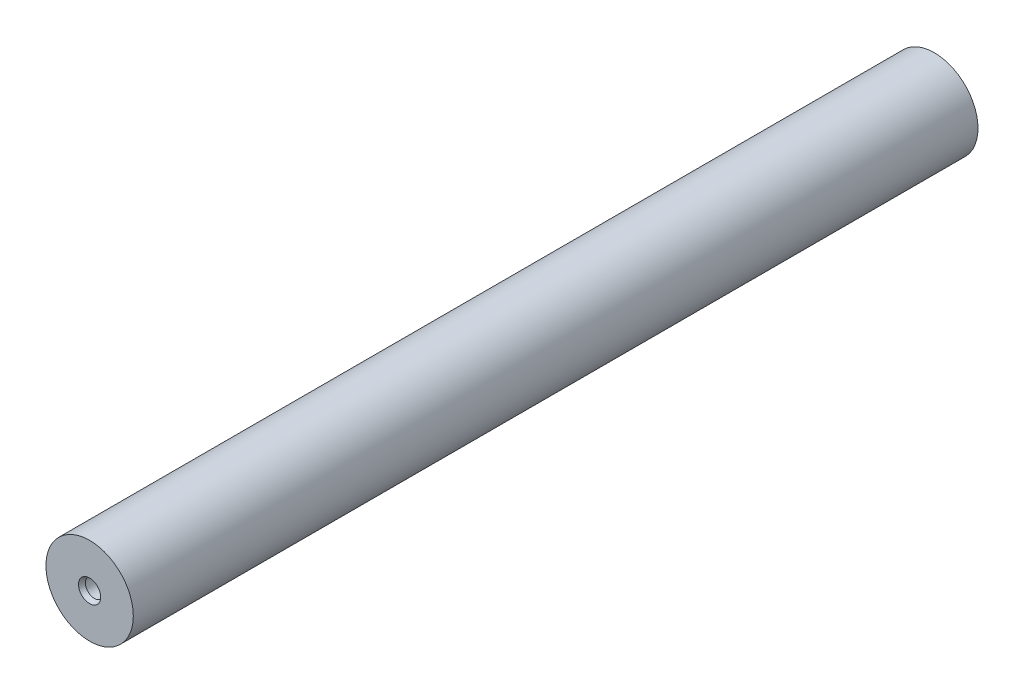
from build123d import *

# Parameters (mm, degrees)
SKETCH_1_R                   = 6
EXTRUDE_1_DEPTH              = 116
HOLE_WIZARD_M3_3_D           = 2.5
HOLE_WIZARD_M3_3_DEPTH       = 6.748924226
HOLE_WIZARD_M3_3_CSINK_D     = 3.05
HOLE_WIZARD_M3_3_CSINK_ANGLE = 45
HOLE_WIZARD_M3_3_TIP         = 0.751075774
HOLE_WIZARD_M3_4_D           = 2.5
HOLE_WIZARD_M3_4_DEPTH       = 6.748924226
HOLE_WIZARD_M3_4_CSINK_D     = 3.05
HOLE_WIZARD_M3_4_CSINK_ANGLE = 45
HOLE_WIZARD_M3_4_TIP         = 0.751075774


with BuildPart() as part:
    # 草圖1 → 填料-伸長1 (new body)
    with BuildSketch(Plane.XY):
        Circle(SKETCH_1_R)
    extrude(amount=EXTRUDE_1_DEPTH)

    # M3 螺紋孔3
    with Locations(Plane.XY.offset(116)):
        with Locations((0, 0)):
            CounterSinkHole(HOLE_WIZARD_M3_3_D / 2, HOLE_WIZARD_M3_3_CSINK_D / 2, depth=HOLE_WIZARD_M3_3_DEPTH, counter_sink_angle=HOLE_WIZARD_M3_3_CSINK_ANGLE)
            with Locations((0, 0, -(HOLE_WIZARD_M3_3_DEPTH + HOLE_WIZARD_M3_3_TIP / 2))):  # 118° drill point
                Cone(0, HOLE_WIZARD_M3_3_D / 2, HOLE_WIZARD_M3_3_TIP, mode=Mode.SUBTRACT)

    # M3 螺紋孔4
    with Locations(Plane(origin=(0, 0, 0), x_dir=(-1, 0, 0), z_dir=(0, 0, -1))):
        with Locations((0, 0)):
            CounterSinkHole(HOLE_WIZARD_M3_4_D / 2, HOLE_WIZARD_M3_4_CSINK_D / 2, depth=HOLE_WIZARD_M3_4_DEPTH, counter_sink_angle=HOLE_WIZARD_M3_4_CSINK_ANGLE)
            with Locations((0, 0, -(HOLE_WIZARD_M3_4_DEPTH + HOLE_WIZARD_M3_4_TIP / 2))):  # 118° drill point
                Cone(0, HOLE_WIZARD_M3_4_D / 2, HOLE_WIZARD_M3_4_TIP, mode=Mode.SUBTRACT)


solid = part.part
